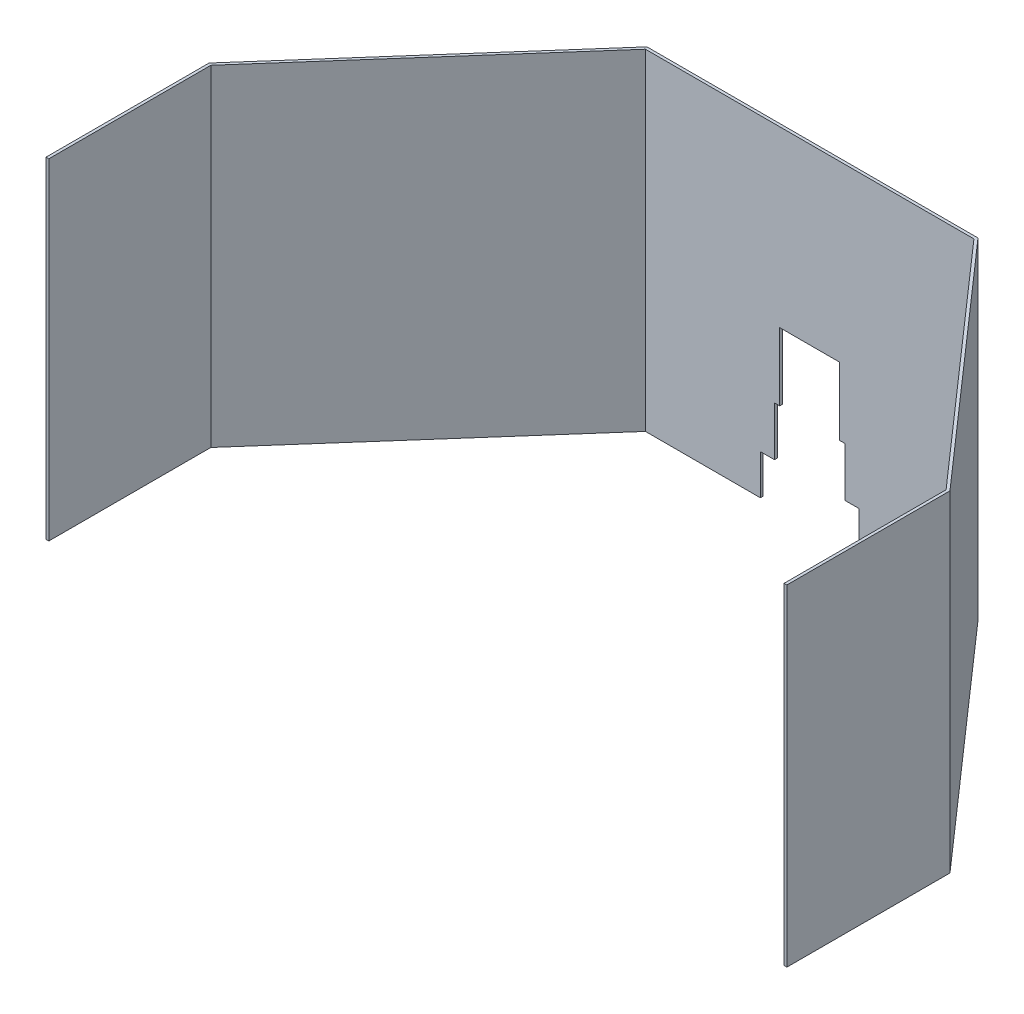
from build123d import *

# Parameters (mm, degrees)
BOSS_EXTRUDE5_DEPTH = 234.9999999
SKETCH4_W           = 42.5
SKETCH4_H           = 48.09999997
CUT_EXTRUDE1_DEPTH  = 2.000000064


with BuildPart() as part:
    # Sketch1 → Boss-Extrude5 (new body)
    with BuildSketch(Plane(origin=(0, 0, 0), x_dir=(1, 0, 0), z_dir=(0, 1, 0))):
        Polygon((-117.504462868, 326.155640462), (117.504462868, 326.155640462), (263.000000064, 160.754471715), (263.000000064, 45.003453118), (261, 45.003453118), (261, 160), (116.600094822, 324.155640398), (-116.600094822, 324.155640398), (-261, 160), (-261, 45.001214275), (-263.000000064, 45.001214275), (-263.000000064, 160.754471715), align=None)
    extrude(amount=BOSS_EXTRUDE5_DEPTH)

    # Sketch4 → Cut-Extrude1 (cut)
    with BuildSketch(Plane(origin=(0, 0, -326.155640462), x_dir=(-1, 0, 0), z_dir=(0, 0, -1))):
        with Locations((0, 87.449999931)):
            Rectangle(SKETCH4_W, SKETCH4_H)
        Polygon((-25, 63.399999946), (-25, 28.4), (25, 28.4), (25, 63.399999946), (21.25, 63.399999946), (-21.25, 63.399999946), align=None)
        Polygon((-25, 28.4), (-35, 28.4), (-35, 0), (35, 0), (35, 28.4), (25, 28.4), align=None)
    extrude(amount=-CUT_EXTRUDE1_DEPTH, mode=Mode.SUBTRACT)


solid = part.part
